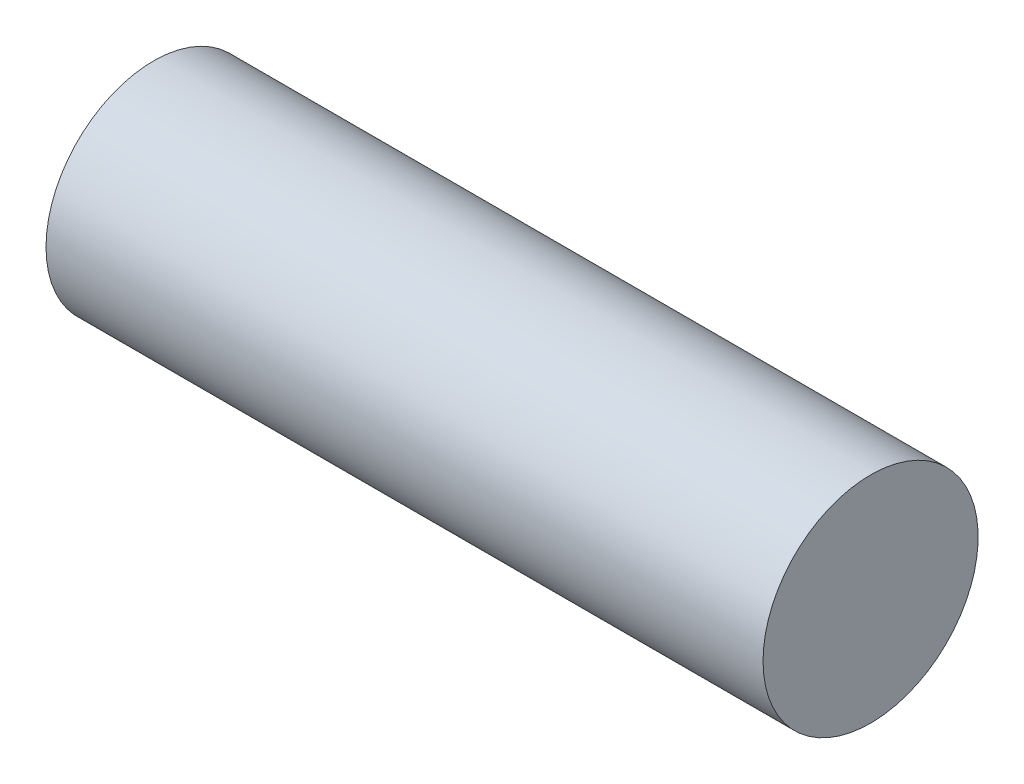
from build123d import *

# Parameters (mm, degrees)
SKETCH1_W = 80
SKETCH1_H = 12


with BuildPart() as part:
    # Sketch1 → Revolve1 (revolve)
    with BuildSketch(Plane.XY, mode=Mode.PRIVATE) as revolve1_sk:
        with Locations((-15.969949917, 0.1)):
            Rectangle(SKETCH1_W, SKETCH1_H)
    revolve(revolve1_sk.sketch.rotate(Axis((-55.969949917, 6.1, 0), (1, 0, 0)), 270), axis=Axis((-55.969949917, 6.1, 0), (1, 0, 0)))


solid = part.part
